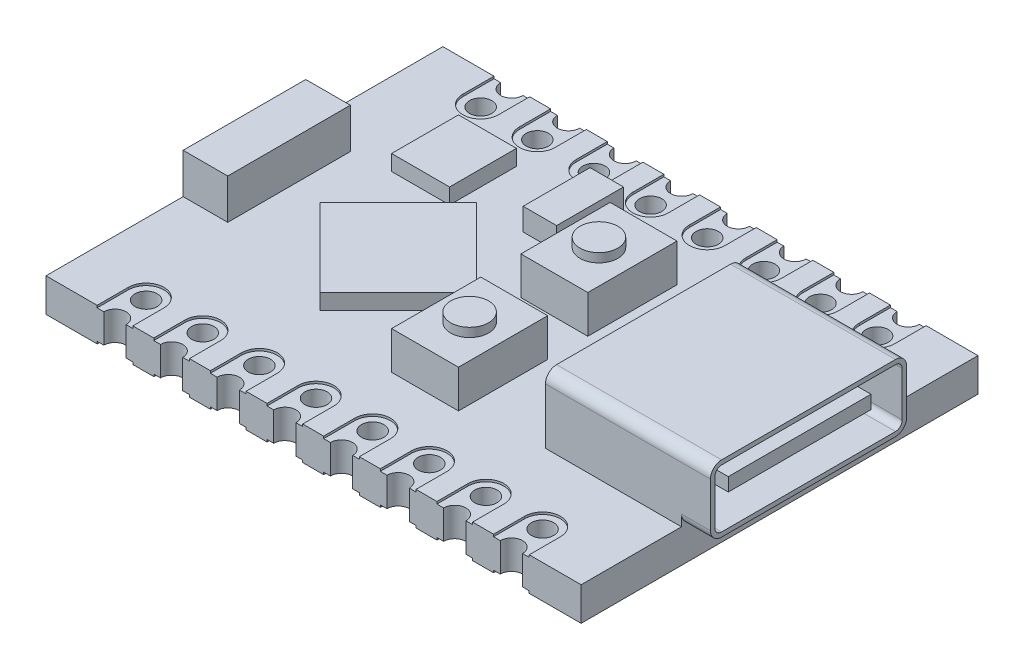
from build123d import *

# Parameters (mm, degrees)
SKETCH2_W             = 24
SKETCH2_H             = 17.8
BOSS_EXTRUDE1_DEPTH   = 1.5
SKETCH3_W             = 2
SKETCH3_H             = 5.5
BOSS_EXTRUDE2_DEPTH   = 1.8
BOSS_EXTRUDE3_DEPTH   = 0.7
SKETCH5_W             = 2.6
SKETCH5_H             = 3
BOSS_EXTRUDE4_DEPTH   = 0.7
SKETCH6_W             = 1.5
SKETCH6_H             = 3
BOSS_EXTRUDE5_DEPTH   = 1
SKETCH7_W             = 3
SKETCH7_H             = 4
BOSS_EXTRUDE6_DEPTH   = 1.7
SKETCH8_R             = 0.85
BOSS_EXTRUDE7_DEPTH   = 0.4
SKETCH9_R             = 0.5
CUT_EXTRUDE1_DEPTH    = 30.954131602
CUT_EXTRUDE2_DEPTH    = 0.1
LPATTERN1_COUNT       = 8
LPATTERN1_PITCH       = 2.54
SKETCH11_R            = 0.5
CUT_EXTRUDE3_DEPTH    = 30.954131602
MIRROR2_COPY_1_DEPTH  = 0.1
MIRROR2_COPY_2_DEPTH  = 0.1
MIRROR2_COPY_3_DEPTH  = 0.1
MIRROR2_COPY_4_DEPTH  = 0.1
MIRROR2_COPY_5_DEPTH  = 0.1
MIRROR2_COPY_6_DEPTH  = 0.1
MIRROR2_COPY_7_DEPTH  = 0.1
MIRROR3_COPY_1_DEPTH  = 0.1
MIRROR3_COPY_2_DEPTH  = 0.1
MIRROR3_COPY_3_DEPTH  = 0.1
MIRROR3_COPY_4_DEPTH  = 0.1
MIRROR3_COPY_5_DEPTH  = 0.1
MIRROR3_COPY_6_DEPTH  = 0.1
MIRROR3_COPY_7_DEPTH  = 0.1
MIRROR3_COPY_8_DEPTH  = 0.1
MIRROR3_COPY_9_DEPTH  = 0.1
MIRROR3_COPY_10_DEPTH = 0.1
MIRROR3_COPY_11_DEPTH = 0.1
MIRROR3_COPY_12_DEPTH = 0.1
MIRROR3_COPY_13_DEPTH = 0.1
MIRROR3_COPY_14_DEPTH = 0.1
MIRROR3_COPY_15_DEPTH = 0.1
SKETCH12_W            = 8.8
SKETCH12_H            = 3
BOSS_EXTRUDE8_DEPTH   = 7.4
FILLET1_R             = 0.5
CUT_EXTRUDE4_DEPTH    = 6.4
SKETCH14_W            = 6.4
SKETCH14_H            = 0.6
BOSS_EXTRUDE9_DEPTH   = 6
SKETCH15_W            = 5.5
SKETCH15_H            = 0.01
CUT_EXTRUDE5_DEPTH    = 0.01


with BuildPart() as part:
    # Sketch2 → Boss-Extrude1 (new body)
    with BuildSketch(Plane(origin=(0, 0, 0), x_dir=(1, 0, 0), z_dir=(0, 1, 0))):
        with Locations((12, 8.9)):
            Rectangle(SKETCH2_W, SKETCH2_H)
    extrude(amount=-BOSS_EXTRUDE1_DEPTH)

    # Sketch3 → Boss-Extrude2 (add)
    with BuildSketch(Plane(origin=(0, 0, 0), x_dir=(1, 0, 0), z_dir=(0, 1, 0))):
        with Locations((1, 8.9)):
            Rectangle(SKETCH3_W, SKETCH3_H)
    extrude(amount=BOSS_EXTRUDE2_DEPTH)

    # Sketch4 → Boss-Extrude3 (add)
    with BuildSketch(Plane(origin=(0, 0, 0), x_dir=(1, 0, 0), z_dir=(0, 1, 0))):
        Polygon((4, 8.3), (7.5, 11.8), (11, 8.3), (7.5, 4.8), align=None)
    extrude(amount=BOSS_EXTRUDE3_DEPTH)

    # Sketch5 → Boss-Extrude4 (add)
    with BuildSketch(Plane(origin=(0, 0, 0), x_dir=(1, 0, 0), z_dir=(0, 1, 0))):
        with Locations((5, 13.3)):
            Rectangle(SKETCH5_W, SKETCH5_H)
    extrude(amount=BOSS_EXTRUDE4_DEPTH)

    # Sketch6 → Boss-Extrude5 (add)
    with BuildSketch(Plane(origin=(0, 0, 0), x_dir=(1, 0, 0), z_dir=(0, 1, 0))):
        with Locations((9.75, 13.9)):
            Rectangle(SKETCH6_W, SKETCH6_H)
    extrude(amount=BOSS_EXTRUDE5_DEPTH)

    # Sketch7 → Boss-Extrude6 (add)
    with BuildSketch(Plane(origin=(0, 0, 0), x_dir=(1, 0, 0), z_dir=(0, 1, 0))):
        with Locations((13, 11.8)):
            Rectangle(SKETCH7_W, SKETCH7_H)
    boss_extrude6 = extrude(amount=BOSS_EXTRUDE6_DEPTH)

    # Sketch8 → Boss-Extrude7 (add)
    with BuildSketch(Plane(origin=(0, 1.7, 0), x_dir=(1, 0, 0), z_dir=(0, 1, 0))):
        with Locations(Location((13, 11.8, 0), (0, 0, 270))):
            Circle(SKETCH8_R)
    boss_extrude7 = extrude(amount=BOSS_EXTRUDE7_DEPTH)

    # Mirror1: Boss-Extrude6, Boss-Extrude7 across plane
    add(boss_extrude6.mirror(Plane(origin=(0, 0, -8.9), x_dir=(1, 0, 0), z_dir=(0, 0, -1))))
    add(boss_extrude7.mirror(Plane(origin=(0, 0, -8.9), x_dir=(1, 0, 0), z_dir=(0, 0, -1))))

    # Sketch9 → Cut-Extrude1 (cut, through all)
    with BuildSketch(Plane(origin=(0, 0, 0), x_dir=(1, 0, 0), z_dir=(0, 1, 0))):
        with Locations(Location((3.093060381, 16.402666124, 0), (0, 0, 270))):
            Circle(SKETCH9_R)
        with Locations(Location((5.633060381, 16.402666124, 0), (0, 0, 270))):
            Circle(SKETCH9_R)
        with Locations(Location((8.173060381, 16.402666124, 0), (0, 0, 270))):
            Circle(SKETCH9_R)
        with Locations(Location((10.713060381, 16.402666124, 0), (0, 0, 270))):
            Circle(SKETCH9_R)
        with Locations(Location((13.253060381, 16.402666124, 0), (0, 0, 270))):
            Circle(SKETCH9_R)
        with Locations(Location((15.793060381, 16.402666124, 0), (0, 0, 270))):
            Circle(SKETCH9_R)
        with Locations(Location((18.333060381, 16.402666124, 0), (0, 0, 270))):
            Circle(SKETCH9_R)
        with Locations(Location((20.873060381, 16.402666124, 0), (0, 0, 270))):
            Circle(SKETCH9_R)
    cut_extrude1 = extrude(amount=-CUT_EXTRUDE1_DEPTH, mode=Mode.SUBTRACT)

    # Sketch10 → Cut-Extrude2 (cut)
    with BuildSketch(Plane(origin=(0, 0, 0), x_dir=(1, 0, 0), z_dir=(0, 1, 0))):
        with BuildLine():
            Line((2.293060381, 16.402666124), (2.293060381, 17.8))
            Line((2.293060381, 17.8), (3.893060381, 17.8))
            Line((3.893060381, 17.8), (3.893060381, 16.402666124))
            ThreePointArc((3.893060381, 16.402666124), (3.093060381, 15.602666124), (2.293060381, 16.402666124))
        make_face()
    cut_extrude2 = extrude(amount=-CUT_EXTRUDE2_DEPTH, mode=Mode.SUBTRACT)

    # LPattern1: Cut-Extrude2 ×8
    with Locations(*[(i * LPATTERN1_PITCH, 0, 0) for i in range(1, LPATTERN1_COUNT)]):
        add(cut_extrude2, mode=Mode.SUBTRACT)

    # Sketch11 → Cut-Extrude3 (cut, through all)
    with BuildSketch(Plane(origin=(0, 0, 0), x_dir=(1, 0, 0), z_dir=(0, 1, 0))):
        with Locations((3.093060381, 17.8)):
            Circle(SKETCH11_R)
        with Locations((5.633060381, 17.8)):
            Circle(SKETCH11_R)
        with Locations((8.173060381, 17.8)):
            Circle(SKETCH11_R)
        with Locations((10.713060381, 17.8)):
            Circle(SKETCH11_R)
        with Locations((13.253060381, 17.8)):
            Circle(SKETCH11_R)
        with Locations((15.793060381, 17.8)):
            Circle(SKETCH11_R)
        with Locations((18.333060381, 17.8)):
            Circle(SKETCH11_R)
        with Locations((20.873060381, 17.8)):
            Circle(SKETCH11_R)
    cut_extrude3 = extrude(amount=-CUT_EXTRUDE3_DEPTH, mode=Mode.SUBTRACT)

    # Mirror2: Cut-Extrude2 across plane
    add(cut_extrude2.mirror(Plane.ZX.offset(-0.75)), mode=Mode.SUBTRACT)

    # Mirror2 copy 1 sketch → Mirror2 copy 1 (cut)
    with BuildSketch(Plane(origin=(2.54, -1.5, 0), x_dir=(1, 0, 0), z_dir=(0, -1, 0))):
        with BuildLine():
            Line((2.293060381, -16.402666124), (2.293060381, -17.8))
            Line((2.293060381, -17.8), (3.893060381, -17.8))
            Line((3.893060381, -17.8), (3.893060381, -16.402666124))
            ThreePointArc((3.893060381, -16.402666124), (3.093060381, -15.602666124), (2.293060381, -16.402666124))
        make_face()
    extrude(amount=-MIRROR2_COPY_1_DEPTH, mode=Mode.SUBTRACT)

    # Mirror2 copy 2 sketch → Mirror2 copy 2 (cut)
    with BuildSketch(Plane(origin=(5.08, -1.5, 0), x_dir=(1, 0, 0), z_dir=(0, -1, 0))):
        with BuildLine():
            Line((2.293060381, -16.402666124), (2.293060381, -17.8))
            Line((2.293060381, -17.8), (3.893060381, -17.8))
            Line((3.893060381, -17.8), (3.893060381, -16.402666124))
            ThreePointArc((3.893060381, -16.402666124), (3.093060381, -15.602666124), (2.293060381, -16.402666124))
        make_face()
    extrude(amount=-MIRROR2_COPY_2_DEPTH, mode=Mode.SUBTRACT)

    # Mirror2 copy 3 sketch → Mirror2 copy 3 (cut)
    with BuildSketch(Plane(origin=(7.62, -1.5, 0), x_dir=(1, 0, 0), z_dir=(0, -1, 0))):
        with BuildLine():
            Line((2.293060381, -16.402666124), (2.293060381, -17.8))
            Line((2.293060381, -17.8), (3.893060381, -17.8))
            Line((3.893060381, -17.8), (3.893060381, -16.402666124))
            ThreePointArc((3.893060381, -16.402666124), (3.093060381, -15.602666124), (2.293060381, -16.402666124))
        make_face()
    extrude(amount=-MIRROR2_COPY_3_DEPTH, mode=Mode.SUBTRACT)

    # Mirror2 copy 4 sketch → Mirror2 copy 4 (cut)
    with BuildSketch(Plane(origin=(10.16, -1.5, 0), x_dir=(1, 0, 0), z_dir=(0, -1, 0))):
        with BuildLine():
            Line((2.293060381, -16.402666124), (2.293060381, -17.8))
            Line((2.293060381, -17.8), (3.893060381, -17.8))
            Line((3.893060381, -17.8), (3.893060381, -16.402666124))
            ThreePointArc((3.893060381, -16.402666124), (3.093060381, -15.602666124), (2.293060381, -16.402666124))
        make_face()
    extrude(amount=-MIRROR2_COPY_4_DEPTH, mode=Mode.SUBTRACT)

    # Mirror2 copy 5 sketch → Mirror2 copy 5 (cut)
    with BuildSketch(Plane(origin=(12.7, -1.5, 0), x_dir=(1, 0, 0), z_dir=(0, -1, 0))):
        with BuildLine():
            Line((2.293060381, -16.402666124), (2.293060381, -17.8))
            Line((2.293060381, -17.8), (3.893060381, -17.8))
            Line((3.893060381, -17.8), (3.893060381, -16.402666124))
            ThreePointArc((3.893060381, -16.402666124), (3.093060381, -15.602666124), (2.293060381, -16.402666124))
        make_face()
    extrude(amount=-MIRROR2_COPY_5_DEPTH, mode=Mode.SUBTRACT)

    # Mirror2 copy 6 sketch → Mirror2 copy 6 (cut)
    with BuildSketch(Plane(origin=(15.24, -1.5, 0), x_dir=(1, 0, 0), z_dir=(0, -1, 0))):
        with BuildLine():
            Line((2.293060381, -16.402666124), (2.293060381, -17.8))
            Line((2.293060381, -17.8), (3.893060381, -17.8))
            Line((3.893060381, -17.8), (3.893060381, -16.402666124))
            ThreePointArc((3.893060381, -16.402666124), (3.093060381, -15.602666124), (2.293060381, -16.402666124))
        make_face()
    extrude(amount=-MIRROR2_COPY_6_DEPTH, mode=Mode.SUBTRACT)

    # Mirror2 copy 7 sketch → Mirror2 copy 7 (cut)
    with BuildSketch(Plane(origin=(17.78, -1.5, 0), x_dir=(1, 0, 0), z_dir=(0, -1, 0))):
        with BuildLine():
            Line((2.293060381, -16.402666124), (2.293060381, -17.8))
            Line((2.293060381, -17.8), (3.893060381, -17.8))
            Line((3.893060381, -17.8), (3.893060381, -16.402666124))
            ThreePointArc((3.893060381, -16.402666124), (3.093060381, -15.602666124), (2.293060381, -16.402666124))
        make_face()
    extrude(amount=-MIRROR2_COPY_7_DEPTH, mode=Mode.SUBTRACT)

    # Mirror3: Cut-Extrude1, Cut-Extrude2, Cut-Extrude3 across plane
    add(cut_extrude1.mirror(Plane(origin=(0, 0, -8.9), x_dir=(1, 0, 0), z_dir=(0, 0, -1))), mode=Mode.SUBTRACT)
    add(cut_extrude2.mirror(Plane(origin=(0, 0, -8.9), x_dir=(1, 0, 0), z_dir=(0, 0, -1))), mode=Mode.SUBTRACT)
    add(cut_extrude3.mirror(Plane(origin=(0, 0, -8.9), x_dir=(1, 0, 0), z_dir=(0, 0, -1))), mode=Mode.SUBTRACT)

    # Mirror3 copy 1 sketch → Mirror3 copy 1 (cut)
    with BuildSketch(Plane(origin=(2.54, 0, -17.8), x_dir=(1, 0, 0), z_dir=(0, 1, 0))):
        with BuildLine():
            Line((2.293060381, -16.402666124), (2.293060381, -17.8))
            Line((2.293060381, -17.8), (3.893060381, -17.8))
            Line((3.893060381, -17.8), (3.893060381, -16.402666124))
            ThreePointArc((3.893060381, -16.402666124), (3.093060381, -15.602666124), (2.293060381, -16.402666124))
        make_face()
    extrude(amount=-MIRROR3_COPY_1_DEPTH, mode=Mode.SUBTRACT)

    # Mirror3 copy 2 sketch → Mirror3 copy 2 (cut)
    with BuildSketch(Plane(origin=(5.08, 0, -17.8), x_dir=(1, 0, 0), z_dir=(0, 1, 0))):
        with BuildLine():
            Line((2.293060381, -16.402666124), (2.293060381, -17.8))
            Line((2.293060381, -17.8), (3.893060381, -17.8))
            Line((3.893060381, -17.8), (3.893060381, -16.402666124))
            ThreePointArc((3.893060381, -16.402666124), (3.093060381, -15.602666124), (2.293060381, -16.402666124))
        make_face()
    extrude(amount=-MIRROR3_COPY_2_DEPTH, mode=Mode.SUBTRACT)

    # Mirror3 copy 3 sketch → Mirror3 copy 3 (cut)
    with BuildSketch(Plane(origin=(7.62, 0, -17.8), x_dir=(1, 0, 0), z_dir=(0, 1, 0))):
        with BuildLine():
            Line((2.293060381, -16.402666124), (2.293060381, -17.8))
            Line((2.293060381, -17.8), (3.893060381, -17.8))
            Line((3.893060381, -17.8), (3.893060381, -16.402666124))
            ThreePointArc((3.893060381, -16.402666124), (3.093060381, -15.602666124), (2.293060381, -16.402666124))
        make_face()
    extrude(amount=-MIRROR3_COPY_3_DEPTH, mode=Mode.SUBTRACT)

    # Mirror3 copy 4 sketch → Mirror3 copy 4 (cut)
    with BuildSketch(Plane(origin=(10.16, 0, -17.8), x_dir=(1, 0, 0), z_dir=(0, 1, 0))):
        with BuildLine():
            Line((2.293060381, -16.402666124), (2.293060381, -17.8))
            Line((2.293060381, -17.8), (3.893060381, -17.8))
            Line((3.893060381, -17.8), (3.893060381, -16.402666124))
            ThreePointArc((3.893060381, -16.402666124), (3.093060381, -15.602666124), (2.293060381, -16.402666124))
        make_face()
    extrude(amount=-MIRROR3_COPY_4_DEPTH, mode=Mode.SUBTRACT)

    # Mirror3 copy 5 sketch → Mirror3 copy 5 (cut)
    with BuildSketch(Plane(origin=(12.7, 0, -17.8), x_dir=(1, 0, 0), z_dir=(0, 1, 0))):
        with BuildLine():
            Line((2.293060381, -16.402666124), (2.293060381, -17.8))
            Line((2.293060381, -17.8), (3.893060381, -17.8))
            Line((3.893060381, -17.8), (3.893060381, -16.402666124))
            ThreePointArc((3.893060381, -16.402666124), (3.093060381, -15.602666124), (2.293060381, -16.402666124))
        make_face()
    extrude(amount=-MIRROR3_COPY_5_DEPTH, mode=Mode.SUBTRACT)

    # Mirror3 copy 6 sketch → Mirror3 copy 6 (cut)
    with BuildSketch(Plane(origin=(15.24, 0, -17.8), x_dir=(1, 0, 0), z_dir=(0, 1, 0))):
        with BuildLine():
            Line((2.293060381, -16.402666124), (2.293060381, -17.8))
            Line((2.293060381, -17.8), (3.893060381, -17.8))
            Line((3.893060381, -17.8), (3.893060381, -16.402666124))
            ThreePointArc((3.893060381, -16.402666124), (3.093060381, -15.602666124), (2.293060381, -16.402666124))
        make_face()
    extrude(amount=-MIRROR3_COPY_6_DEPTH, mode=Mode.SUBTRACT)

    # Mirror3 copy 7 sketch → Mirror3 copy 7 (cut)
    with BuildSketch(Plane(origin=(17.78, 0, -17.8), x_dir=(1, 0, 0), z_dir=(0, 1, 0))):
        with BuildLine():
            Line((2.293060381, -16.402666124), (2.293060381, -17.8))
            Line((2.293060381, -17.8), (3.893060381, -17.8))
            Line((3.893060381, -17.8), (3.893060381, -16.402666124))
            ThreePointArc((3.893060381, -16.402666124), (3.093060381, -15.602666124), (2.293060381, -16.402666124))
        make_face()
    extrude(amount=-MIRROR3_COPY_7_DEPTH, mode=Mode.SUBTRACT)

    # Mirror3 copy 8 sketch → Mirror3 copy 8 (cut)
    with BuildSketch(Plane(origin=(0, -1.5, -17.8), x_dir=(1, 0, 0), z_dir=(0, -1, 0))):
        with BuildLine():
            Line((2.293060381, 16.402666124), (2.293060381, 17.8))
            Line((2.293060381, 17.8), (3.893060381, 17.8))
            Line((3.893060381, 17.8), (3.893060381, 16.402666124))
            ThreePointArc((3.893060381, 16.402666124), (3.093060381, 15.602666124), (2.293060381, 16.402666124))
        make_face()
    extrude(amount=-MIRROR3_COPY_8_DEPTH, mode=Mode.SUBTRACT)

    # Mirror3 copy 9 sketch → Mirror3 copy 9 (cut)
    with BuildSketch(Plane(origin=(2.54, -1.5, -17.8), x_dir=(1, 0, 0), z_dir=(0, -1, 0))):
        with BuildLine():
            Line((2.293060381, 16.402666124), (2.293060381, 17.8))
            Line((2.293060381, 17.8), (3.893060381, 17.8))
            Line((3.893060381, 17.8), (3.893060381, 16.402666124))
            ThreePointArc((3.893060381, 16.402666124), (3.093060381, 15.602666124), (2.293060381, 16.402666124))
        make_face()
    extrude(amount=-MIRROR3_COPY_9_DEPTH, mode=Mode.SUBTRACT)

    # Mirror3 copy 10 sketch → Mirror3 copy 10 (cut)
    with BuildSketch(Plane(origin=(5.08, -1.5, -17.8), x_dir=(1, 0, 0), z_dir=(0, -1, 0))):
        with BuildLine():
            Line((2.293060381, 16.402666124), (2.293060381, 17.8))
            Line((2.293060381, 17.8), (3.893060381, 17.8))
            Line((3.893060381, 17.8), (3.893060381, 16.402666124))
            ThreePointArc((3.893060381, 16.402666124), (3.093060381, 15.602666124), (2.293060381, 16.402666124))
        make_face()
    extrude(amount=-MIRROR3_COPY_10_DEPTH, mode=Mode.SUBTRACT)

    # Mirror3 copy 11 sketch → Mirror3 copy 11 (cut)
    with BuildSketch(Plane(origin=(7.62, -1.5, -17.8), x_dir=(1, 0, 0), z_dir=(0, -1, 0))):
        with BuildLine():
            Line((2.293060381, 16.402666124), (2.293060381, 17.8))
            Line((2.293060381, 17.8), (3.893060381, 17.8))
            Line((3.893060381, 17.8), (3.893060381, 16.402666124))
            ThreePointArc((3.893060381, 16.402666124), (3.093060381, 15.602666124), (2.293060381, 16.402666124))
        make_face()
    extrude(amount=-MIRROR3_COPY_11_DEPTH, mode=Mode.SUBTRACT)

    # Mirror3 copy 12 sketch → Mirror3 copy 12 (cut)
    with BuildSketch(Plane(origin=(10.16, -1.5, -17.8), x_dir=(1, 0, 0), z_dir=(0, -1, 0))):
        with BuildLine():
            Line((2.293060381, 16.402666124), (2.293060381, 17.8))
            Line((2.293060381, 17.8), (3.893060381, 17.8))
            Line((3.893060381, 17.8), (3.893060381, 16.402666124))
            ThreePointArc((3.893060381, 16.402666124), (3.093060381, 15.602666124), (2.293060381, 16.402666124))
        make_face()
    extrude(amount=-MIRROR3_COPY_12_DEPTH, mode=Mode.SUBTRACT)

    # Mirror3 copy 13 sketch → Mirror3 copy 13 (cut)
    with BuildSketch(Plane(origin=(12.7, -1.5, -17.8), x_dir=(1, 0, 0), z_dir=(0, -1, 0))):
        with BuildLine():
            Line((2.293060381, 16.402666124), (2.293060381, 17.8))
            Line((2.293060381, 17.8), (3.893060381, 17.8))
            Line((3.893060381, 17.8), (3.893060381, 16.402666124))
            ThreePointArc((3.893060381, 16.402666124), (3.093060381, 15.602666124), (2.293060381, 16.402666124))
        make_face()
    extrude(amount=-MIRROR3_COPY_13_DEPTH, mode=Mode.SUBTRACT)

    # Mirror3 copy 14 sketch → Mirror3 copy 14 (cut)
    with BuildSketch(Plane(origin=(15.24, -1.5, -17.8), x_dir=(1, 0, 0), z_dir=(0, -1, 0))):
        with BuildLine():
            Line((2.293060381, 16.402666124), (2.293060381, 17.8))
            Line((2.293060381, 17.8), (3.893060381, 17.8))
            Line((3.893060381, 17.8), (3.893060381, 16.402666124))
            ThreePointArc((3.893060381, 16.402666124), (3.093060381, 15.602666124), (2.293060381, 16.402666124))
        make_face()
    extrude(amount=-MIRROR3_COPY_14_DEPTH, mode=Mode.SUBTRACT)

    # Mirror3 copy 15 sketch → Mirror3 copy 15 (cut)
    with BuildSketch(Plane(origin=(17.78, -1.5, -17.8), x_dir=(1, 0, 0), z_dir=(0, -1, 0))):
        with BuildLine():
            Line((2.293060381, 16.402666124), (2.293060381, 17.8))
            Line((2.293060381, 17.8), (3.893060381, 17.8))
            Line((3.893060381, 17.8), (3.893060381, 16.402666124))
            ThreePointArc((3.893060381, 16.402666124), (3.093060381, 15.602666124), (2.293060381, 16.402666124))
        make_face()
    extrude(amount=-MIRROR3_COPY_15_DEPTH, mode=Mode.SUBTRACT)

    # Sketch12 → Boss-Extrude8 (add)
    with BuildSketch(Plane(origin=(25.3, 0, 0), x_dir=(0, 0, -1), z_dir=(1, 0, 0))):
        with Locations((8.9, 1.5)):
            Rectangle(SKETCH12_W, SKETCH12_H)
    extrude(amount=-BOSS_EXTRUDE8_DEPTH)

    # Fillet1
    fillet1_edges = [part.edges().sort_by_distance(p)[0] for p in [
        (21.6, 3, -13.3),
        (24.65, 0, -13.3),
        (24.65, 0, -4.5),
        (21.6, 3, -4.5),
    ]]
    fillet(fillet1_edges, radius=FILLET1_R)

    # Sketch13 → Cut-Extrude4 (cut)
    with BuildSketch(Plane(origin=(25.3, 0, 0), x_dir=(0, 0, -1), z_dir=(1, 0, 0))):
        with BuildLine():
            Line((13.1, 0.5), (13.1, 2.5))
            ThreePointArc((13.1, 2.5), (13.012132034, 2.712132034), (12.8, 2.8))
            Line((12.8, 2.8), (5, 2.8))
            ThreePointArc((5, 2.8), (4.787867966, 2.712132034), (4.7, 2.5))
            Line((4.7, 2.5), (4.7, 0.5))
            ThreePointArc((4.7, 0.5), (4.787867966, 0.287867966), (5, 0.2))
            Line((5, 0.2), (12.8, 0.2))
            ThreePointArc((12.8, 0.2), (13.012132034, 0.287867966), (13.1, 0.5))
        make_face()
    extrude(amount=-CUT_EXTRUDE4_DEPTH, mode=Mode.SUBTRACT)

    # Sketch14 → Boss-Extrude9 (add)
    with BuildSketch(Plane(origin=(18.9, 0, 0), x_dir=(0, 0, -1), z_dir=(1, 0, 0))):
        with Locations((8.9, 1.5)):
            Rectangle(SKETCH14_W, SKETCH14_H)
    extrude(amount=BOSS_EXTRUDE9_DEPTH)

    # Sketch15 → Cut-Extrude5 (cut)
    with BuildSketch(Plane.ZY):
        with Locations((-8.9, 0.005)):
            Rectangle(SKETCH15_W, SKETCH15_H)
    extrude(amount=-CUT_EXTRUDE5_DEPTH, mode=Mode.SUBTRACT)


solid = part.part
